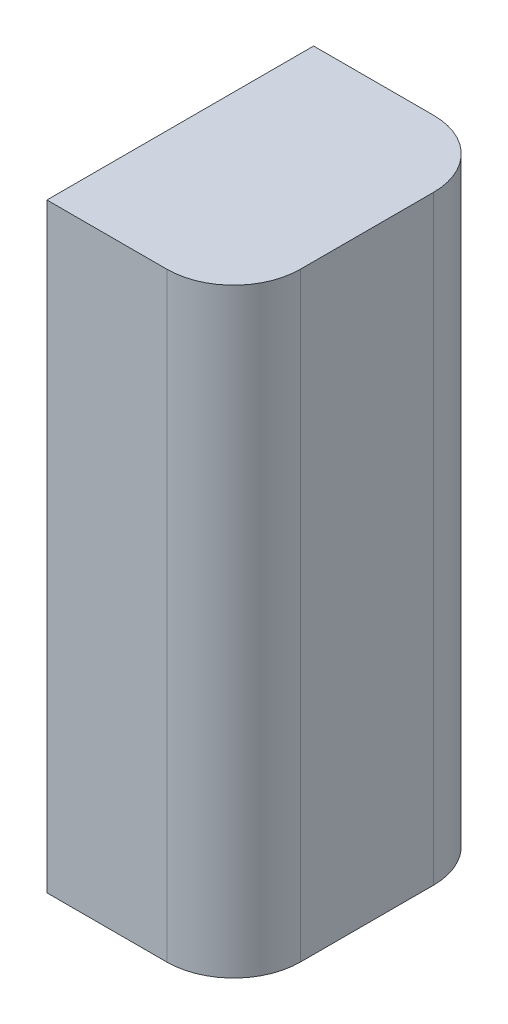
from build123d import *

# Parameters (mm, degrees)
BOSS_EXTRUDE1_DEPTH = 285.75


with BuildPart() as part:
    # Sketch1 → Boss-Extrude1 (new body)
    with BuildSketch(Plane(origin=(0, 0, 0), x_dir=(1, 0, 0), z_dir=(0, 1, 0))):
        with BuildLine():
            Line((0, 0), (57.15, 0))
            ThreePointArc((57.15, 0), (79.600640303, 9.299359697), (88.9, 31.75))
            Line((88.9, 31.75), (88.9, 95.25))
            ThreePointArc((88.9, 95.25), (79.600640303, 117.700640303), (57.15, 127))
            Line((57.15, 127), (0, 127))
            Line((0, 127), (0, 0))
        make_face()
    extrude(amount=BOSS_EXTRUDE1_DEPTH)


solid = part.part
